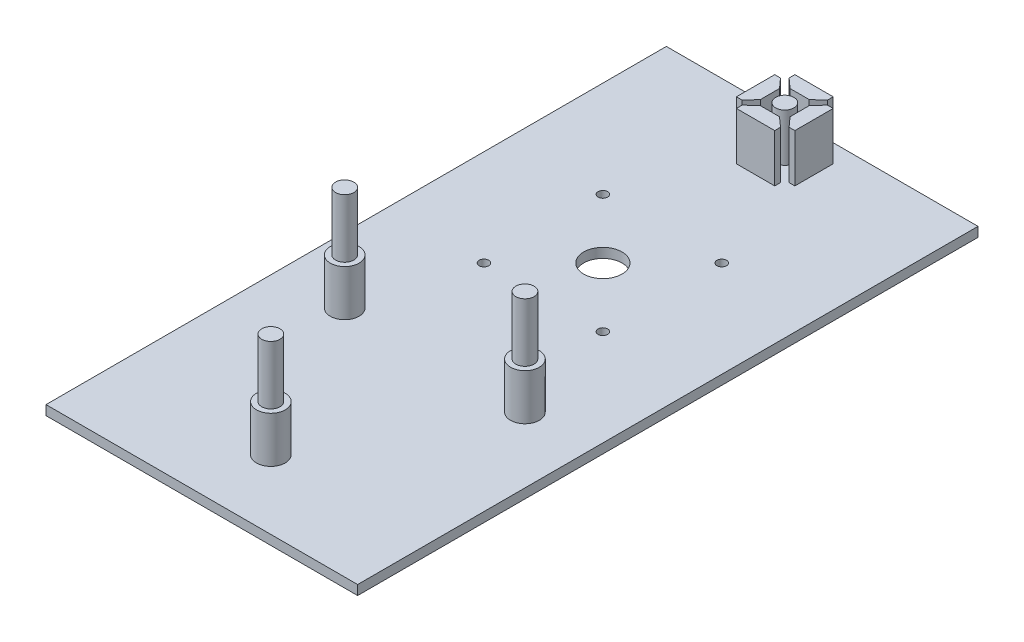
from build123d import *

# Parameters (mm, degrees)
SKETCH1_R               = 5.08
SKETCH1_R_2             = 1.27
BASE_EXTRUDE_DEPTH      = 2.54
SKETCH6_R               = 2.413
MIDDLE_BAR_HOLDER_DEPTH = 12.7
SKETCH7_R               = 2.413
BOSS_EXTRUDE6_DEPTH     = 27.686
SKETCH7_3_R             = 3.81
SKETCH7_3_R_2           = 2.413
BOSS_EXTRUDE7_DEPTH     = 12.192


with BuildPart() as part:
    # Sketch1 → base extrude (new body)
    with BuildSketch(Plane(origin=(0, 0, 0), x_dir=(1, 0, 0), z_dir=(0, 1, 0))):
        Polygon((82.55, -164.338), (82.55, -58.1000108), (82.55, 0), (0, 0), (0, -164.338), align=None)
        with Locations(Location((41.275, -58.1000108, 0), (0, 0, 270))):
            Circle(SKETCH1_R, mode=Mode.SUBTRACT)
        with Locations(Location((25.527, -42.3520108, 0), (0, 0, 270))):
            Circle(SKETCH1_R_2, mode=Mode.SUBTRACT)
        with Locations(Location((57.023, -42.3520108, 0), (0, 0, 270))):
            Circle(SKETCH1_R_2, mode=Mode.SUBTRACT)
        with Locations(Location((25.527, -73.8480108, 0), (0, 0, 270))):
            Circle(SKETCH1_R_2, mode=Mode.SUBTRACT)
        with Locations(Location((57.023, -73.8480108, 0), (0, 0, 270))):
            Circle(SKETCH1_R_2, mode=Mode.SUBTRACT)
    extrude(amount=BASE_EXTRUDE_DEPTH)

    # Sketch6 → middle bar holder (add)
    with BuildSketch(Plane(origin=(0, 2.54, 0), x_dir=(1, 0, 0), z_dir=(0, 1, 0))):
        Polygon((33.528, -9.906), (33.528, -4.826), (35.052, -4.826), (37.338, -7.366), (37.338, -9.906), (37.338, -12.446), (35.052, -14.986), (33.528, -14.986), align=None)
        with Locations(Location((41.275, -9.906, 0), (0, 0, 270))):
            Circle(SKETCH6_R)
        Polygon((41.275, -2.159), (46.355, -2.159), (46.355, -3.683), (43.815, -5.969), (41.275, -5.969), (38.735, -5.969), (36.195, -3.683), (36.195, -2.159), align=None)
        Polygon((47.498, -14.986), (45.212, -12.446), (45.212, -9.906), (45.212, -7.366), (47.498, -4.826), (49.022, -4.826), (49.022, -9.906), (49.022, -14.986), align=None)
        Polygon((41.275, -17.653), (36.195, -17.653), (36.195, -16.129), (38.735, -13.843), (41.275, -13.843), (43.815, -13.843), (46.355, -16.129), (46.355, -17.653), align=None)
    extrude(amount=MIDDLE_BAR_HOLDER_DEPTH)

    # Sketch7 → Boss-Extrude6 (add)
    with BuildSketch(Plane(origin=(0, 2.54, 0), x_dir=(1, 0, 0), z_dir=(0, 1, 0))):
        with Locations(Location((17.399, -102.616, 0), (0, 0, 270))):
            Circle(SKETCH7_R)
        with Locations(Location((41.275, -146.05, 0), (0, 0, 270))):
            Circle(SKETCH7_R)
        with Locations(Location((65.151, -102.616, 0), (0, 0, 270))):
            Circle(SKETCH7_R)
    extrude(amount=BOSS_EXTRUDE6_DEPTH)

    # Sketch7<3> → Boss-Extrude7 (add)
    # profile 1 of 3: a face of its own
    with BuildSketch(Plane(origin=(0, 2.54, 0), x_dir=(1, 0, 0), z_dir=(0, 1, 0))):
        with Locations(Location((41.275, -146.05, 0), (0, 0, 90))):
            Circle(SKETCH7_3_R)
        with Locations(Location((41.275, -146.05, 0), (0, 0, 270))):
            Circle(SKETCH7_3_R_2, mode=Mode.SUBTRACT)
    # profile 2 of 3: a face of its own
    with BuildSketch(Plane(origin=(0, 2.54, 0), x_dir=(1, 0, 0), z_dir=(0, 1, 0))):
        with Locations(Location((65.151, -102.616, 0), (0, 0, 90))):
            Circle(SKETCH7_3_R)
        with Locations(Location((65.151, -102.616, 0), (0, 0, 270))):
            Circle(SKETCH7_3_R_2, mode=Mode.SUBTRACT)
    # profile 3 of 3: a face of its own
    with BuildSketch(Plane(origin=(0, 2.54, 0), x_dir=(1, 0, 0), z_dir=(0, 1, 0))):
        with Locations(Location((17.399, -102.616, 0), (0, 0, 90))):
            Circle(SKETCH7_3_R)
        with Locations(Location((17.399, -102.616, 0), (0, 0, 270))):
            Circle(SKETCH7_3_R_2, mode=Mode.SUBTRACT)
    extrude(amount=BOSS_EXTRUDE7_DEPTH)


solid = part.part
